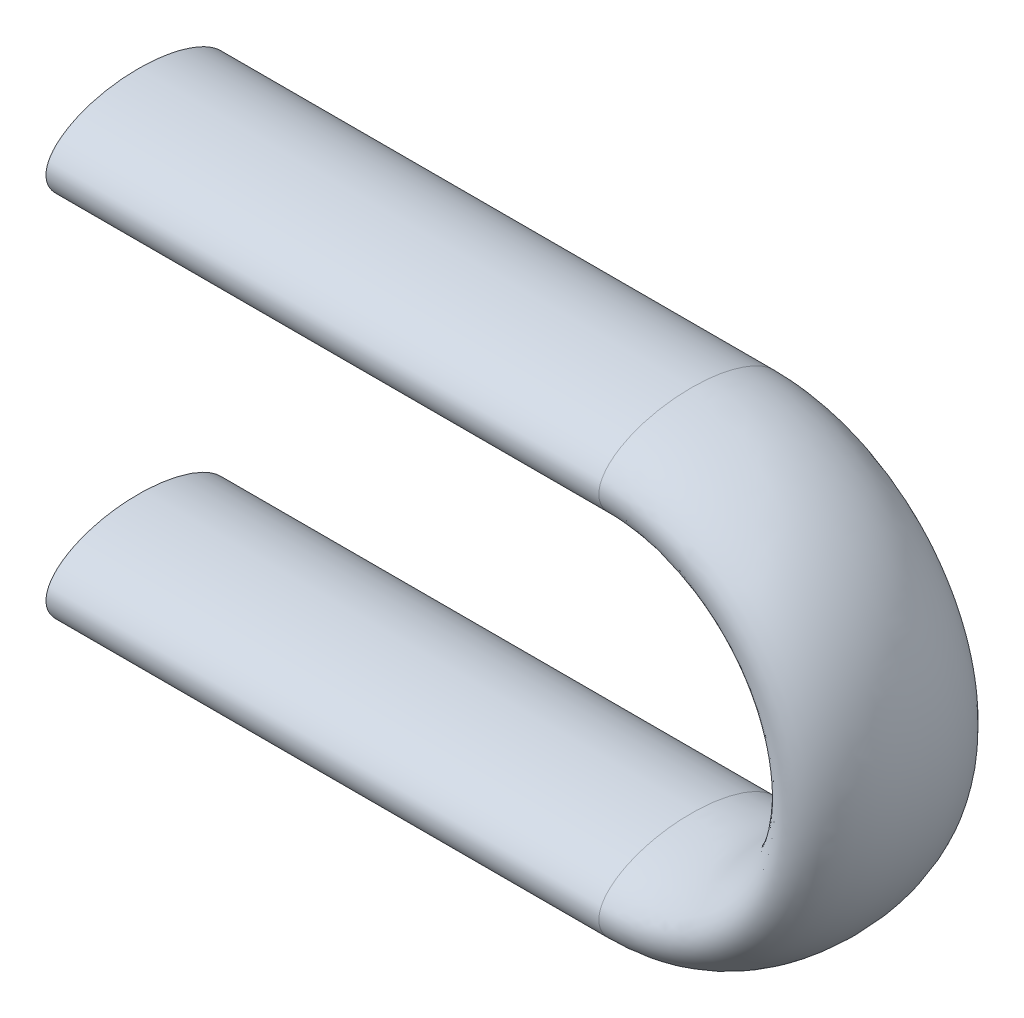
from build123d import *

# Parameters (mm, degrees)
SKETCH2_RX = 50.8
SKETCH2_RY = 25.4
SKETCH3_R  = 19.05


with BuildPart() as part:
    # Sweep1: sweep along a path in Sketch1
    with BuildLine(Plane.XY) as sweep1_path:
        Line((0, 0), (304.8, 0))
        ThreePointArc((304.8, 0), (406.4, -101.6), (304.8, -203.2))
        Line((304.8, -203.2), (0, -203.2))
    # Sketch2 → Sweep1 (sweep)
    with BuildSketch(Plane(origin=(0, 0, 0), x_dir=(0, 0, -1), z_dir=(1, 0, 0))):
        with Locations(Location((0, 0), (0, 0, -180))):
            Ellipse(SKETCH2_RX, SKETCH2_RY)
    sweep(path=sweep1_path.line)

    # Cut-Sweep1: sweep along a path in Sketch1<4>
    with BuildLine(Plane.XY) as cut_sweep1_path:
        Line((0, 0), (304.8, 0))
        ThreePointArc((304.8, 0), (406.4, -101.6), (304.8, -203.2))
        Line((304.8, -203.2), (0, -203.2))
    # Sketch3 → Cut-Sweep1 (sweep, cut)
    with BuildSketch(Plane.ZY):
        Circle(SKETCH3_R)
    sweep(path=cut_sweep1_path.line, mode=Mode.SUBTRACT)


solid = part.part
